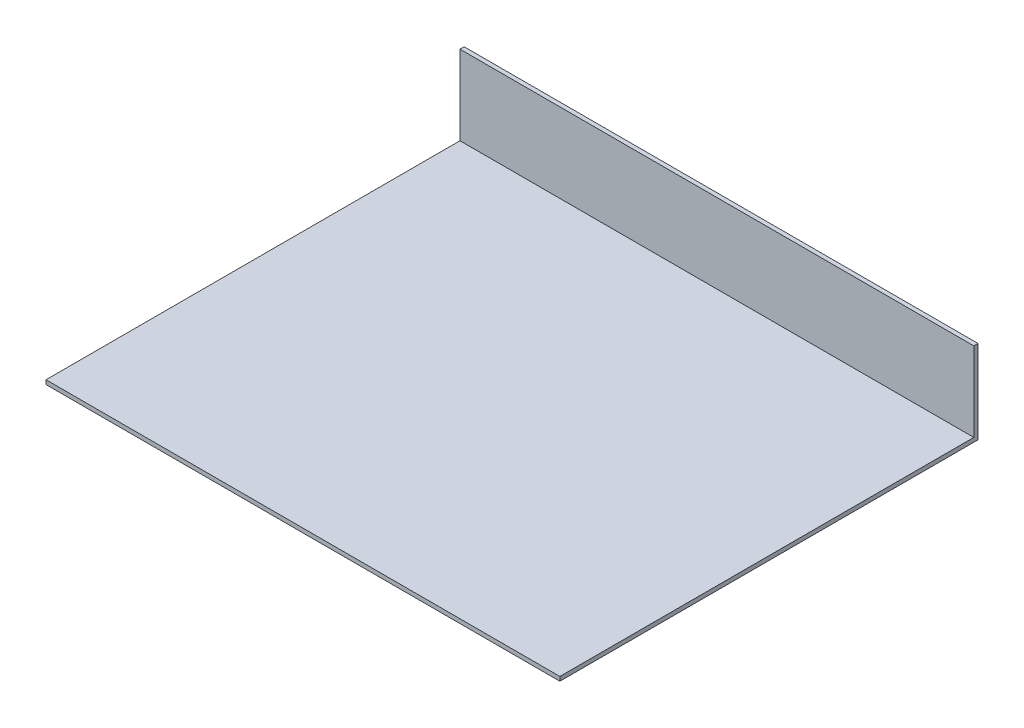
from build123d import *

# Parameters (mm, degrees)
SKETCH2_W           = 368.69
SKETCH2_H           = 300
BOSS_EXTRUDE1_DEPTH = 3
SKETCH3_W           = 368.69
SKETCH3_H           = 3
BOSS_EXTRUDE2_DEPTH = 56.91


with BuildPart() as part:
    # Sketch2 → Boss-Extrude1 (new body)
    with BuildSketch(Plane(origin=(0, 0, 0), x_dir=(1, 0, 0), z_dir=(0, 1, 0))):
        Rectangle(SKETCH2_W, SKETCH2_H)
    extrude(amount=BOSS_EXTRUDE1_DEPTH)

    # Sketch3 → Boss-Extrude2 (add)
    with BuildSketch(Plane(origin=(0, 3, 0), x_dir=(1, 0, 0), z_dir=(0, 1, 0))):
        with Locations((0, 148.5)):
            Rectangle(SKETCH3_W, SKETCH3_H)
    extrude(amount=BOSS_EXTRUDE2_DEPTH)


solid = part.part
